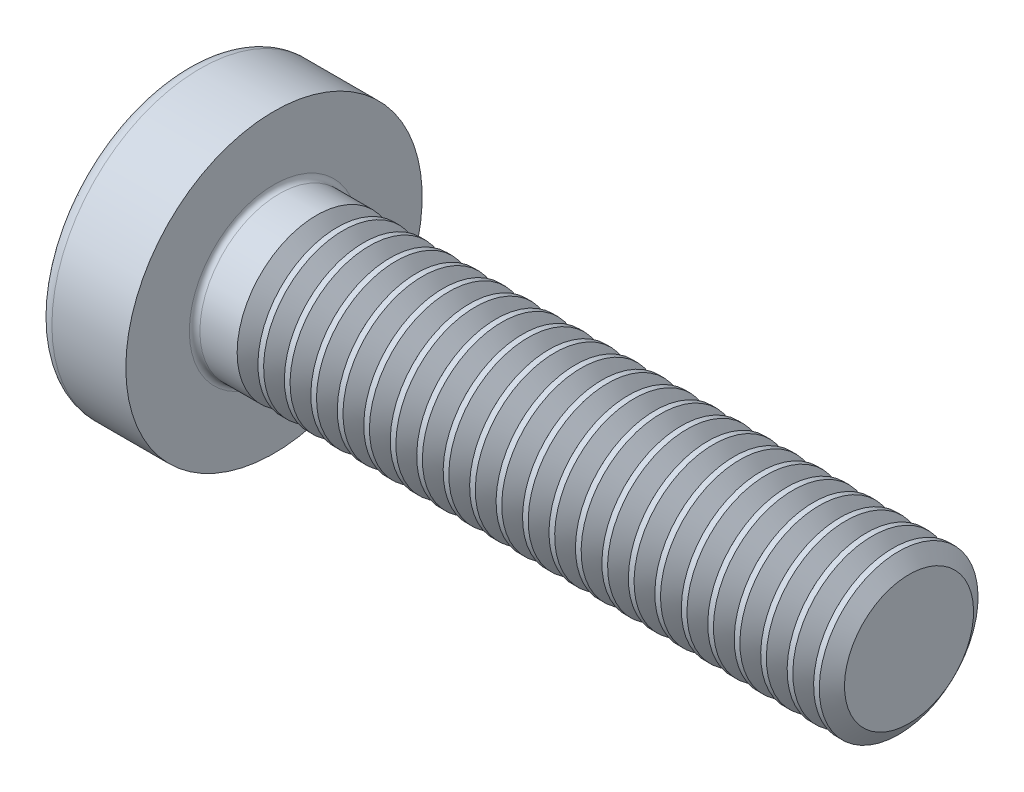
from build123d import *

# Parameters (mm, degrees)
FILLET1_R       = 0.1
RECPAT_COUNT    = 2
RECPAT_ANGLE    = 90
THDSCHPAT_COUNT = 23
THDSCHPAT_PITCH = 0.5


with BuildPart() as part:
    # BodySke → Base-Revolve (revolve)
    with BuildSketch(Plane.XY, mode=Mode.PRIVATE) as base_revolve_sk:
        with BuildLine():
            Line((2.4, 1.5), (2.4, 2.8))
            Line((2.4, 2.8), (1.003501533, 2.8))
            ThreePointArc((1.003501533, 2.8), (0.873295971, 2.76653015), (0.775371599, 2.674418605))
            ThreePointArc((0.775371599, 2.674418605), (0.197753546, 1.392274756), (0, 0))
            Line((0, 0), (14.4, 0))
            Line((14.4, 0), (14.4, 1.5))
            Line((14.4, 1.5), (2.4, 1.5))
        make_face()
    revolve(base_revolve_sk.sketch.rotate(Axis((1.003501533, 0, 0), (1, 0, 0)), 90), axis=Axis((1.003501533, 0, 0), (1, 0, 0)))

    # Fillet1
    fillet1_edges = [part.edges().sort_by_distance(p)[0] for p in [
        (2.4, 0, -1.5),
    ]]
    fillet(fillet1_edges, radius=FILLET1_R)

    # Sketch3 → Recess section 0
    with BuildSketch(Plane(origin=(0, 0, 0), x_dir=(0, 0, -1), z_dir=(1, 0, 0))):
        with BuildLine():
            Line((0.37, -1.4), (-0.37, -1.4))
            Line((-0.37, -1.4), (-0.37, 1.4))
            Line((-0.37, 1.4), (0.37, 1.4))
            Line((0.37, 1.4), (0.37, -1.4))
        make_face()
    # Sketch4 → Recess section 1
    with BuildSketch(Plane(origin=(1.75, 0, 0), x_dir=(0, 0, -1), z_dir=(1, 0, 0))):
        with BuildLine():
            Line((0.37, -0.527482216), (-0.37, -0.527482216))
            Line((-0.37, -0.527482216), (-0.37, 0.527482216))
            Line((-0.37, 0.527482216), (0.37, 0.527482216))
            Line((0.37, 0.527482216), (0.37, -0.527482216))
        make_face()
    recess = loft(mode=Mode.SUBTRACT)

    # RecPat: Recess ×2 about axis
    recpat_axis = Axis((0, 0, 0), (1, 0, 0))
    for i in range(1, RECPAT_COUNT):
        add(recess.rotate(recpat_axis, i * RECPAT_ANGLE / (RECPAT_COUNT - 1)), mode=Mode.SUBTRACT)

    # RecCorSke → RecessCore (revolve, cut)
    with BuildSketch(Plane.XY, mode=Mode.PRIVATE) as recesscore_sk:
        Polygon((0, 0), (0, 0.678371921), (1.75, 0.556), (1.930655351, 0), align=None)
    revolve(recesscore_sk.sketch.rotate(Axis((-3.175, 0, 0), (1, 0, 0)), 15.814025764), axis=Axis((-3.175, 0, 0), (1, 0, 0)), mode=Mode.SUBTRACT)

    # ThdSchSke → ThreadSchematic (revolve, cut)
    with BuildSketch(Plane.XY, mode=Mode.PRIVATE) as threadschematic_sk:
        Polygon((3.4, -1.2195), (3.203591786, -1.5), (3.203591786, -1.875), (3.596408214, -1.875), (3.596408214, -1.5), align=None)
    threadschematic = revolve(threadschematic_sk.sketch.rotate(Axis((-3.175, 0, 0), (1, 0, 0)), 270), axis=Axis((-3.175, 0, 0), (1, 0, 0)), mode=Mode.SUBTRACT)

    # ThdSchPat: ThreadSchematic ×23
    with Locations(*[(i * THDSCHPAT_PITCH, 0, 0) for i in range(1, THDSCHPAT_COUNT)]):
        add(threadschematic, mode=Mode.SUBTRACT)


solid = part.part
